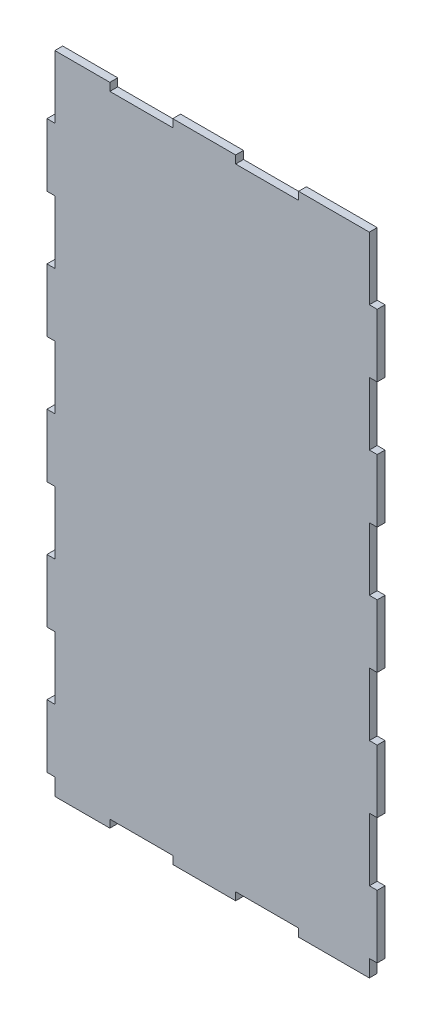
from build123d import *

# Parameters (mm, degrees)
BOSS_EXTRUDE1_DEPTH = 6.35


with BuildPart() as part:
    # Sketch1 → Boss-Extrude1 (new body)
    with BuildSketch(Plane.XY):
        Polygon((6.35, 521.67), (6.35, 470.87), (0, 470.87), (0, 420.07), (6.35, 420.07), (6.35, 369.27), (0, 369.27), (0, 318.47), (6.35, 318.47), (6.35, 267.67), (0, 267.67), (0, 216.87), (6.35, 216.87), (6.35, 166.07), (0, 166.07), (0, 115.27), (6.35, 115.27), (6.35, 64.47), (0, 64.47), (0, 13.67), (6.35, 13.67), (6.35, 0), (50.8, 0), (50.8, 6.35), (101.6, 6.35), (101.6, 0), (152.4, 0), (152.4, 6.35), (203.2, 6.35), (203.2, 0), (254, 0), (260.35, 0), (260.35, 6.35), (260.35, 13.67), (266.7, 13.67), (266.7, 64.47), (260.35, 64.47), (260.35, 115.27), (266.7, 115.27), (266.7, 166.07), (260.35, 166.07), (260.35, 216.87), (266.7, 216.87), (266.7, 267.67), (260.35, 267.67), (260.35, 318.47), (266.7, 318.47), (266.7, 369.27), (260.35, 369.27), (260.35, 420.07), (266.7, 420.07), (266.7, 470.87), (260.35, 470.87), (260.35, 521.67), (254, 521.67), (203.2, 521.67), (203.2, 515.32), (152.4, 515.32), (152.4, 521.67), (101.6, 521.67), (101.6, 515.32), (50.8, 515.32), (50.8, 521.67), align=None)
    extrude(amount=BOSS_EXTRUDE1_DEPTH)


solid = part.part
